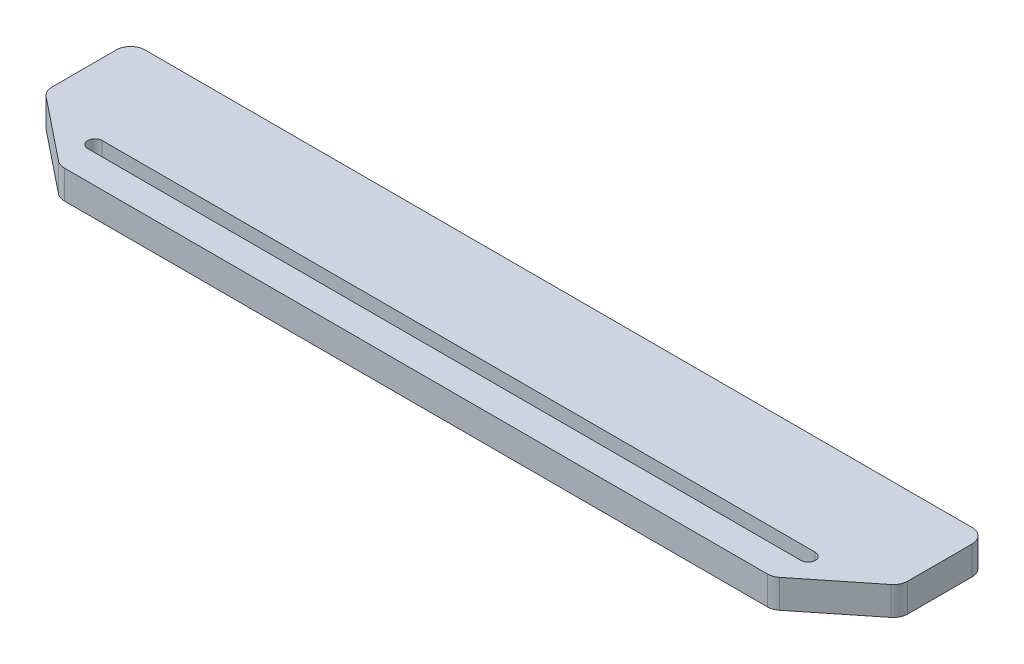
from build123d import *

# Parameters (mm, degrees)
BOSS_EXTRUDE1_DEPTH     = 10
CUT_EXTRUDE4_DEPTH      = 305.302481094
CUT_EXTRUDE4_DEPTH_BACK = 305.302481094


with BuildPart() as part:
    # Sketch1 → Boss-Extrude1 (new body)
    with BuildSketch(Plane(origin=(0, 0, 0), x_dir=(1, 0, 0), z_dir=(0, 1, 0))):
        with BuildLine():
            Line((0, -5), (0, -27.596875763))
            ThreePointArc((0, -27.596875763), (0.493483818, -29.762819415), (1.876524762, -31.50121981))
            Line((1.876524762, -31.50121981), (23.630430059, -48.904344047))
            ThreePointArc((23.630430059, -48.904344047), (25.09887059, -49.718141596), (26.753905297, -50))
            Line((26.753905297, -50), (273.246094703, -50))
            ThreePointArc((273.246094703, -50), (274.90112941, -49.718141596), (276.369569941, -48.904344047))
            Line((276.369569941, -48.904344047), (298.123475238, -31.50121981))
            ThreePointArc((298.123475238, -31.50121981), (299.506516182, -29.762819415), (300, -27.596875763))
            Line((300, -27.596875763), (300, -5))
            ThreePointArc((300, -5), (298.535533906, -1.464466094), (295, 0))
            Line((295, 0), (5, 0))
            ThreePointArc((5, 0), (1.464466094, -1.464466094), (0, -5))
        make_face()
    extrude(amount=BOSS_EXTRUDE1_DEPTH)

    # Sketch2 → Cut-Extrude4 (cut, two sides: drawn at the far end of the back side and taken through both)
    with BuildSketch(Plane(origin=(0, 0, 0), x_dir=(1, 0, 0), z_dir=(0, 1, 0)).offset(-CUT_EXTRUDE4_DEPTH_BACK)):
        with BuildLine():
            Line((25, -35), (275, -35))
            ThreePointArc((275, -35), (277.5, -37.5), (275, -40))
            Line((275, -40), (25, -40))
            ThreePointArc((25, -40), (22.5, -37.5), (25, -35))
        make_face()
    extrude(amount=CUT_EXTRUDE4_DEPTH + CUT_EXTRUDE4_DEPTH_BACK, mode=Mode.SUBTRACT)


solid = part.part
